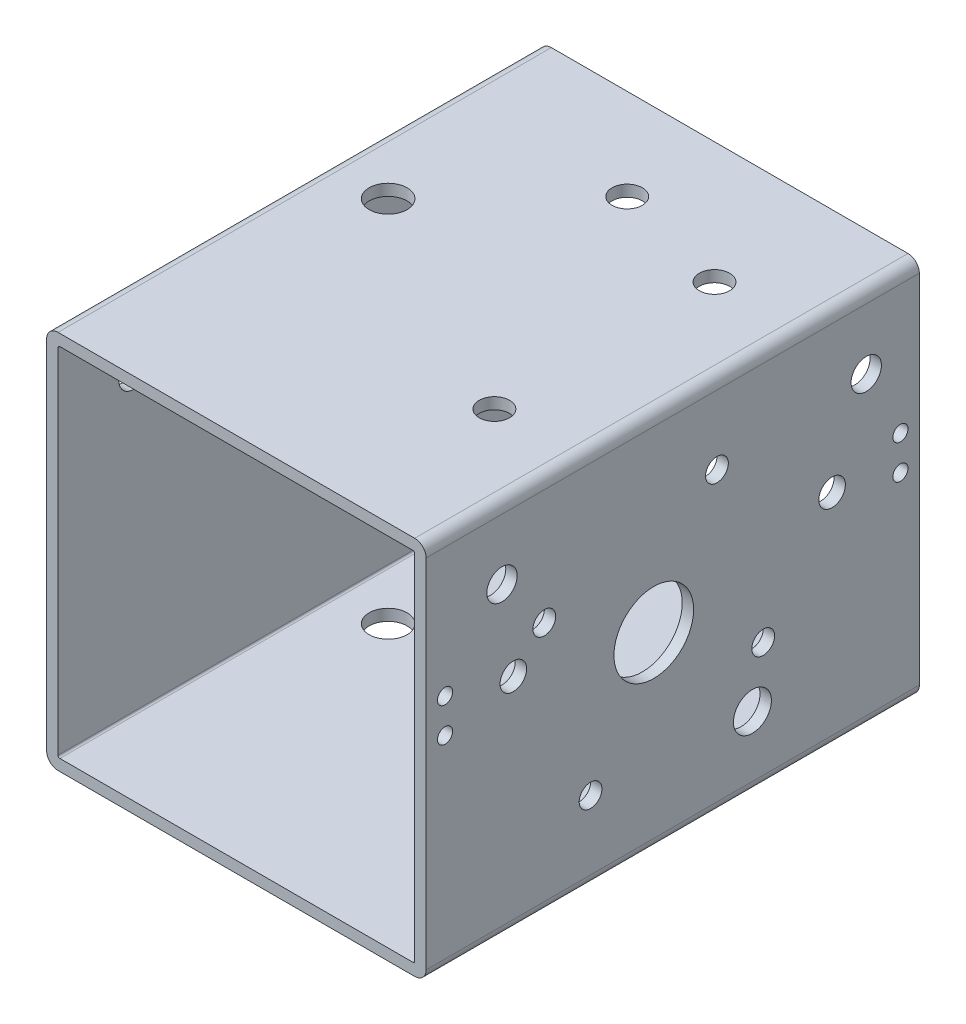
from build123d import *

# Parameters (mm, degrees)
SKETCH1_W                      = 100
SKETCH1_H                      = 100
SKETCH1_W_2                    = 94
SKETCH1_H_2                    = 94
EXTRUDE_THIN1_DEPTH            = 130
FILLET1_R                      = 0.5
FILLET2_R                      = 3
F_8_0_8_DIAMETER_HOLE2_D       = 8
F_8_0_8_DIAMETER_HOLE3_D       = 8
F_10_0_10_DIAMETER_HOLE1_D     = 10
F_10_0_10_DIAMETER_HOLE2_D     = 10
M8X1_25_TAPPED_HOLE1_D         = 6.8
M8X1_25_TAPPED_HOLE1_DEPTH     = 3
M8X1_25_TAPPED_HOLE2_D         = 6.8
M8X1_25_TAPPED_HOLE2_DEPTH     = 3
F_21_0_21_DIAMETER_HOLE1_D     = 21
F_21_0_21_DIAMETER_HOLE1_DEPTH = 3
F_6_0_6_DIAMETER_HOLE1_D       = 6
F_6_0_6_DIAMETER_HOLE1_DEPTH   = 3
F_8_0_8_DIAMETER_HOLE4_D       = 8
F_8_0_8_DIAMETER_HOLE4_DEPTH   = 3
CUT_EXTRUDE1_REACH             = 173.464
SKETCH31_R                     = 2
SKETCH31_R_2                   = 3.5


with BuildPart() as part:
    # Sketch1 → Extrude-Thin1 (new body)
    with BuildSketch(Plane.XY):
        Rectangle(SKETCH1_W, SKETCH1_H)
        Rectangle(SKETCH1_W_2, SKETCH1_H_2, mode=Mode.SUBTRACT)
    extrude(amount=EXTRUDE_THIN1_DEPTH)

    # Fillet1
    fillet1_edges = [part.edges().sort_by_distance(p)[0] for p in [
        (47, -47, 65),
        (47, 47, 65),
        (-47, 47, 65),
        (-47, -47, 65),
    ]]
    fillet(fillet1_edges, radius=FILLET1_R)

    # Fillet2
    fillet2_edges = [part.edges().sort_by_distance(p)[0] for p in [
        (50, -50, 65),
        (-50, -50, 65),
        (-50, 50, 65),
        (50, 50, 65),
    ]]
    fillet(fillet2_edges, radius=FILLET2_R)

    # Ø8.0 (8) Diameter Hole2 (through all)
    with Locations(Plane(origin=(0, 50, 0), x_dir=(1, 0, 0), z_dir=(0, 1, 0))):
        with Locations((28, -32), (28, -90)):
            Hole(F_8_0_8_DIAMETER_HOLE2_D / 2)

    # Ø8.0 (8) Diameter Hole3 (through all)
    with Locations(Plane(origin=(50, 0, 0), x_dir=(0, 0, -1), z_dir=(1, 0, 0))):
        with Locations((-14, 31), (-110, 31)):
            Hole(F_8_0_8_DIAMETER_HOLE3_D / 2)

    # Ø10.0 (10) Diameter Hole1 (through all)
    with Locations(Plane(origin=(0, 50, 0), x_dir=(1, 0, 0), z_dir=(0, 1, 0))):
        with Locations((-34, -56)):
            Hole(F_10_0_10_DIAMETER_HOLE1_D / 2)

    # Ø10.0 (10) Diameter Hole2 (through all)
    with Locations(Plane(origin=(50, 0, 0), x_dir=(0, 0, -1), z_dir=(1, 0, 0))):
        with Locations((-44, -31)):
            Hole(F_10_0_10_DIAMETER_HOLE2_D / 2)

    # M8x1.25 Tapped Hole1
    with Locations(Plane.ZY.offset(50)):
        with Locations((56, -15), (56, 35)):
            Hole(M8X1_25_TAPPED_HOLE1_D / 2, depth=M8X1_25_TAPPED_HOLE1_DEPTH)

    # M8x1.25 Tapped Hole2
    with Locations(Plane(origin=(0, -50, 0), x_dir=(-1, 0, 0), z_dir=(0, -1, 0))):
        with Locations((20, -44), (-35, -44)):
            Hole(M8X1_25_TAPPED_HOLE2_D / 2, depth=M8X1_25_TAPPED_HOLE2_DEPTH)

    # Ø21.0 (21) Diameter Hole1
    with Locations(Plane(origin=(50, 0, 0), x_dir=(0, 0, -1), z_dir=(1, 0, 0))):
        with Locations((-70, 0)):
            Hole(F_21_0_21_DIAMETER_HOLE1_D / 2, depth=F_21_0_21_DIAMETER_HOLE1_DEPTH)

    # Ø6.0 (6) Diameter Hole1
    with Locations(Plane(origin=(50, 0, 0), x_dir=(0, 0, -1), z_dir=(1, 0, 0))):
        with Locations((-41.157258279, -16.652364697), (-53.347635303, 28.842741721), (-98.842741721, 16.652364697), (-86.652364697, -28.842741721)):
            Hole(F_6_0_6_DIAMETER_HOLE1_D / 2, depth=F_6_0_6_DIAMETER_HOLE1_DEPTH)

    # Ø8.0 (8) Diameter Hole4
    with Locations(Plane(origin=(0, 50, 0), x_dir=(1, 0, 0), z_dir=(0, 1, 0))):
        with Locations((-3, -24)):
            Hole(F_8_0_8_DIAMETER_HOLE4_D / 2, depth=F_8_0_8_DIAMETER_HOLE4_DEPTH)

    # Sketch31 → Cut-Extrude1 (cut, up to next)
    with BuildSketch(Plane(origin=(50, 0, 0), x_dir=(0, 0, -1), z_dir=(1, 0, 0)), mode=Mode.PRIVATE) as cut_extrude1_sk1:
        with Locations(Location((-5, 4, 0), (0, 0, 90))):
            Circle(SKETCH31_R)
    cut_extrude1_tool1 = extrude(cut_extrude1_sk1.sketch, amount=-CUT_EXTRUDE1_REACH, mode=Mode.PRIVATE) & part.part
    # Sketch31 → Cut-Extrude1 (cut, up to next)
    with BuildSketch(Plane(origin=(50, 0, 0), x_dir=(0, 0, -1), z_dir=(1, 0, 0)), mode=Mode.PRIVATE) as cut_extrude1_sk2:
        with Locations(Location((-5, 13, 0), (0, 0, 90))):
            Circle(SKETCH31_R)
    cut_extrude1_tool2 = extrude(cut_extrude1_sk2.sketch, amount=-CUT_EXTRUDE1_REACH, mode=Mode.PRIVATE) & part.part
    # Sketch31 → Cut-Extrude1 (cut, up to next)
    with BuildSketch(Plane(origin=(50, 0, 0), x_dir=(0, 0, -1), z_dir=(1, 0, 0)), mode=Mode.PRIVATE) as cut_extrude1_sk3:
        with Locations(Location((-125, 13, 0), (0, 0, 90))):
            Circle(SKETCH31_R)
    cut_extrude1_tool3 = extrude(cut_extrude1_sk3.sketch, amount=-CUT_EXTRUDE1_REACH, mode=Mode.PRIVATE) & part.part
    # Sketch31 → Cut-Extrude1 (cut, up to next)
    with BuildSketch(Plane(origin=(50, 0, 0), x_dir=(0, 0, -1), z_dir=(1, 0, 0)), mode=Mode.PRIVATE) as cut_extrude1_sk4:
        with Locations(Location((-125, 4, 0), (0, 0, 90))):
            Circle(SKETCH31_R)
    cut_extrude1_tool4 = extrude(cut_extrude1_sk4.sketch, amount=-CUT_EXTRUDE1_REACH, mode=Mode.PRIVATE) & part.part
    # Sketch31 → Cut-Extrude1 (cut, up to next)
    with BuildSketch(Plane(origin=(50, 0, 0), x_dir=(0, 0, -1), z_dir=(1, 0, 0)), mode=Mode.PRIVATE) as cut_extrude1_sk5:
        with Locations(Location((-23, 8.5, 0), (0, 0, 90))):
            Circle(SKETCH31_R_2)
    cut_extrude1_tool5 = extrude(cut_extrude1_sk5.sketch, amount=-CUT_EXTRUDE1_REACH, mode=Mode.PRIVATE) & part.part
    # Sketch31 → Cut-Extrude1 (cut, up to next)
    with BuildSketch(Plane(origin=(50, 0, 0), x_dir=(0, 0, -1), z_dir=(1, 0, 0)), mode=Mode.PRIVATE) as cut_extrude1_sk6:
        with Locations(Location((-107, 8.5, 0), (0, 0, 90))):
            Circle(SKETCH31_R_2)
    cut_extrude1_tool6 = extrude(cut_extrude1_sk6.sketch, amount=-CUT_EXTRUDE1_REACH, mode=Mode.PRIVATE) & part.part
    add(cut_extrude1_tool1.solids().sort_by_distance((50, 4, 5))[0], mode=Mode.SUBTRACT)
    add(cut_extrude1_tool2.solids().sort_by_distance((50, 13, 5))[0], mode=Mode.SUBTRACT)
    add(cut_extrude1_tool3.solids().sort_by_distance((50, 13, 125))[0], mode=Mode.SUBTRACT)
    add(cut_extrude1_tool4.solids().sort_by_distance((50, 4, 125))[0], mode=Mode.SUBTRACT)
    add(cut_extrude1_tool5.solids().sort_by_distance((50, 8.5, 23))[0], mode=Mode.SUBTRACT)
    add(cut_extrude1_tool6.solids().sort_by_distance((50, 8.5, 107))[0], mode=Mode.SUBTRACT)


solid = part.part
